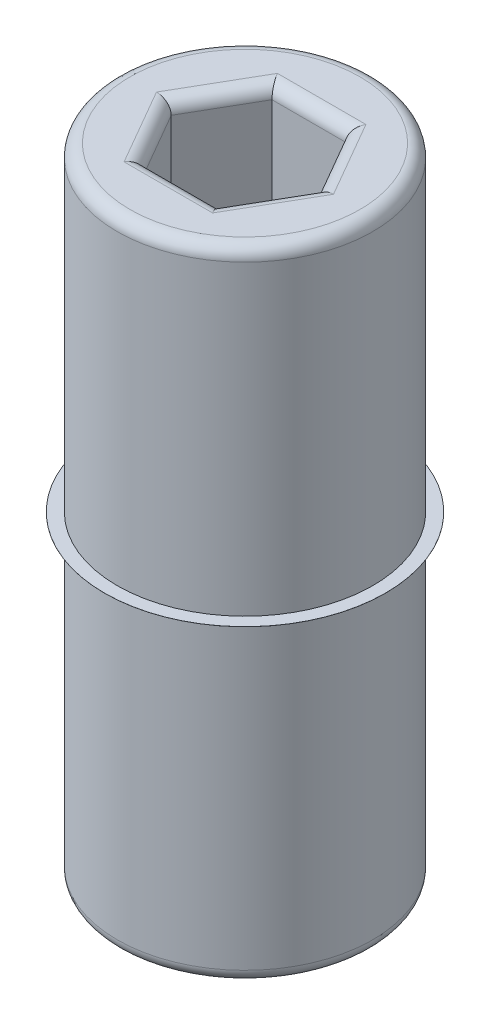
from build123d import *

# Parameters (mm, degrees)
SKETCH_1_R          = 2
EXTRUDE_1_DEPTH     = 5
CUT_EXTRUDE_1_DEPTH = 1.75
FILLET_1_R          = 0.2
SKETCH_2_R          = 2.2
EXTRUDE_2_DEPTH     = 0.0005


with BuildPart() as part:
    # 草图1 → 凸台-拉伸1 (new, symmetric)
    with BuildSketch(Plane(origin=(0, 0, 0), x_dir=(1, 0, 0), z_dir=(0, 1, 0))):
        with Locations(Location((0, 0, 0), (0, 0, 270))):
            Circle(SKETCH_1_R)
    extrude(amount=EXTRUDE_1_DEPTH, both=True)

    # 草图3 → 切除-拉伸1 (cut)
    with BuildSketch(Plane(origin=(0, 5, 0), x_dir=(1, 0, 0), z_dir=(0, 1, 0))):
        Polygon((1.154700538, 0), (0.577350269, 1), (-0.577350269, 1), (-1.154700538, 0), (-0.577350269, -1), (0.577350269, -1), align=None)
    extrude(amount=-CUT_EXTRUDE_1_DEPTH, mode=Mode.SUBTRACT)

    # 圆角1
    fillet_1_edges = [part.edges().sort_by_distance(p)[0] for p in [
        (0.866025404, 5, 0.5),
        (0.866025404, 5, -0.5),
        (0, 5, -1),
        (-0.866025404, 5, -0.5),
        (-0.866025404, 5, 0.5),
        (0, 5, 1),
        (0, -5, -2),
        (0, 5, -2),
    ]]
    fillet(fillet_1_edges, radius=FILLET_1_R)

    # 草图2 → 凸台-拉伸2 (add, symmetric)
    with BuildSketch(Plane(origin=(0, 0, 0), x_dir=(1, 0, 0), z_dir=(0, 1, 0))):
        with Locations(Location((0, 0, 0), (0, 0, 270))):
            Circle(SKETCH_2_R)
    extrude(amount=EXTRUDE_2_DEPTH, both=True)


solid = part.part
